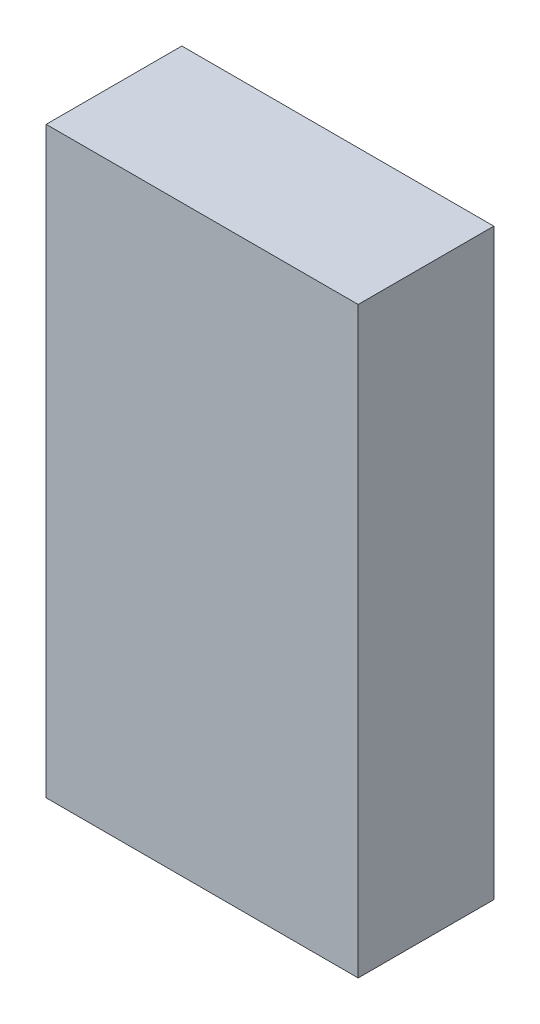
from build123d import *

# Parameters (mm, degrees)
SKETCH1_W           = 115
SKETCH1_H           = 215
BOSS_EXTRUDE1_DEPTH = 50


with BuildPart() as part:
    # Sketch1 → Boss-Extrude1 (new body)
    with BuildSketch(Plane.XY):
        with Locations((57.5, 107.5)):
            Rectangle(SKETCH1_W, SKETCH1_H)
    extrude(amount=BOSS_EXTRUDE1_DEPTH)


solid = part.part
